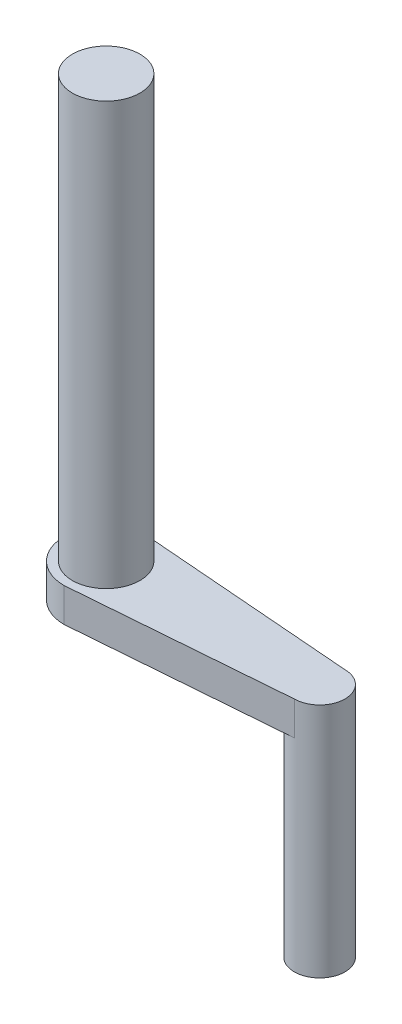
from build123d import *

# Parameters (mm, degrees)
BOSS_EXTRUDE5_DEPTH = 2
SKETCH5_R           = 2
BOSS_EXTRUDE6_DEPTH = 25
BOSS_EXTRUDE7_START = 12
SKETCH6_R           = 1.5
BOSS_EXTRUDE7_DEPTH = 12


with BuildPart() as part:
    # Sketch1 → Boss-Extrude5 (new body)
    with BuildSketch(Plane(origin=(0, 0, 0), x_dir=(1, 0, 0), z_dir=(0, 1, 0))):
        with BuildLine():
            Line((-80.770804267, 29.795413952), (-68.129526639, 28.795413952))
            ThreePointArc((-68.129526639, 28.795413952), (-66.629526639, 27.295413952), (-68.129526639, 25.795413952))
            Line((-68.129526639, 25.795413952), (-80.770804267, 24.795413952))
            ThreePointArc((-80.770804267, 24.795413952), (-83.270804267, 27.295413952), (-80.770804267, 29.795413952))
        make_face()
    extrude(amount=BOSS_EXTRUDE5_DEPTH)

    # Sketch5 → Boss-Extrude6 (add)
    with BuildSketch(Plane(origin=(0, 2, 0), x_dir=(1, 0, 0), z_dir=(0, 1, 0))):
        with Locations(Location((-80.770804267, 27.295413952, 0), (0, 0, 270))):
            Circle(SKETCH5_R)
    extrude(amount=BOSS_EXTRUDE6_DEPTH)

    # Sketch6 → Boss-Extrude7 (add)
    with BuildSketch(Plane.XZ.offset(BOSS_EXTRUDE7_START)):
        with Locations(Location((-68.129526639, -27.295413952, 0), (0, 0, 270))):
            Circle(SKETCH6_R)
    extrude(amount=-BOSS_EXTRUDE7_DEPTH)


solid = part.part
